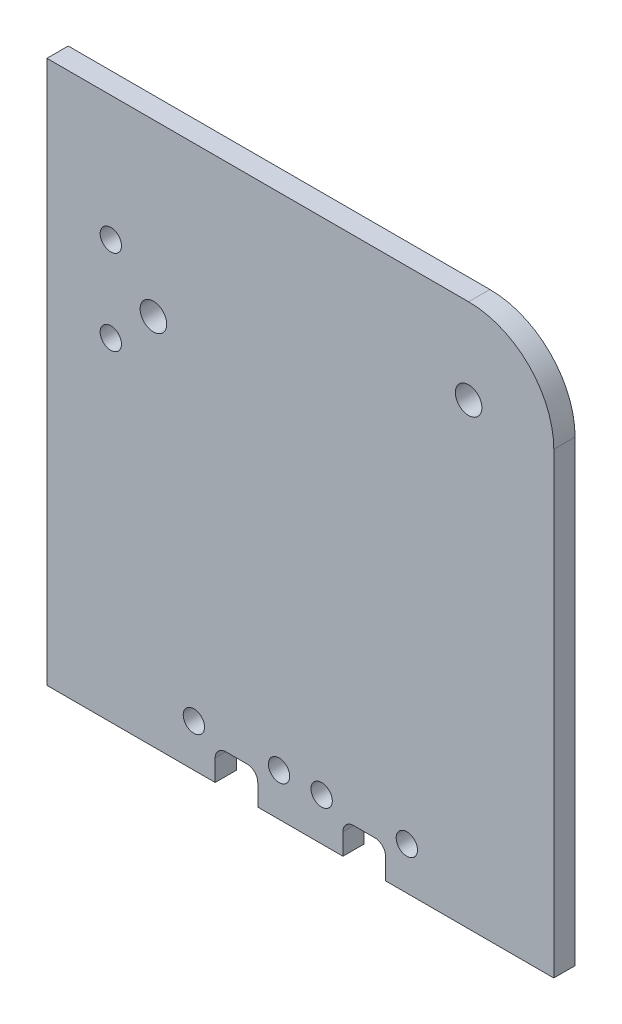
from build123d import *

# Parameters (mm, degrees)
SKETCH_1_R      = 1.25
SKETCH_1_R_2    = 1
EXTRUDE_2_DEPTH = 2


with BuildPart() as part:
    # 草圖1 → 填料-伸長2 (new body)
    with BuildSketch(Plane.XY):
        with BuildLine():
            Line((-28.541905067, -5.335177429), (-28.541905067, -52.335177429))
            Line((-28.541905067, -52.335177429), (-28.541905067, -53.6179941))
            Line((-28.541905067, -53.6179941), (-28.541905067, -55.6179941))
            Line((-28.541905067, -55.6179941), (-12.741905067, -55.6179941))
            Line((-12.741905067, -55.6179941), (-12.741905067, -53.6179941))
            ThreePointArc((-12.741905067, -53.6179941), (-12.449011848, -52.910887319), (-11.741905067, -52.6179941))
            Line((-11.741905067, -52.6179941), (-9.741905067, -52.6179941))
            ThreePointArc((-9.741905067, -52.6179941), (-9.034798286, -52.910887319), (-8.741905067, -53.6179941))
            Line((-8.741905067, -53.6179941), (-8.741905067, -55.6179941))
            Line((-8.741905067, -55.6179941), (-0.741905067, -55.6179941))
            Line((-0.741905067, -55.6179941), (-0.741905067, -53.6179941))
            ThreePointArc((-0.741905067, -53.6179941), (-0.449011848, -52.910887319), (0.258094933, -52.6179941))
            Line((0.258094933, -52.6179941), (2.258094933, -52.6179941))
            ThreePointArc((2.258094933, -52.6179941), (2.965201714, -52.910887319), (3.258094933, -53.6179941))
            Line((3.258094933, -53.6179941), (3.258094933, -55.6179941))
            Line((3.258094933, -55.6179941), (19.058094933, -55.6179941))
            Line((19.058094933, -55.6179941), (19.058094933, -53.900810772))
            Line((19.058094933, -53.900810772), (19.058094933, -52.6179941))
            Line((19.058094933, -52.6179941), (19.058094933, -12.6179941))
            ThreePointArc((19.058094933, -12.6179941), (16.714949182, -6.961139851), (11.058094933, -4.6179941))
            Line((11.058094933, -4.6179941), (-27.541905067, -4.6179941))
            Line((-27.541905067, -4.6179941), (-28.541905067, -4.6179941))
            Line((-28.541905067, -4.6179941), (-28.541905067, -5.335177429))
        make_face()
        with Locations((-18.541905067, -20.6179941)):
            Circle(SKETCH_1_R, mode=Mode.SUBTRACT)
        with Locations((-6.741905067, -51.6179941)):
            Circle(SKETCH_1_R_2, mode=Mode.SUBTRACT)
        with Locations((-22.541905067, -16.3679941)):
            Circle(SKETCH_1_R_2, mode=Mode.SUBTRACT)
        with Locations((-22.541905067, -24.3679941)):
            Circle(SKETCH_1_R_2, mode=Mode.SUBTRACT)
        with Locations((11.058094933, -12.6179941)):
            Circle(SKETCH_1_R, mode=Mode.SUBTRACT)
        with Locations((-14.741905067, -51.6179941)):
            Circle(SKETCH_1_R_2, mode=Mode.SUBTRACT)
        with Locations((5.258094933, -51.6179941)):
            Circle(SKETCH_1_R_2, mode=Mode.SUBTRACT)
        with Locations((-2.741905067, -51.6179941)):
            Circle(SKETCH_1_R_2, mode=Mode.SUBTRACT)
    extrude(amount=EXTRUDE_2_DEPTH)


solid = part.part
